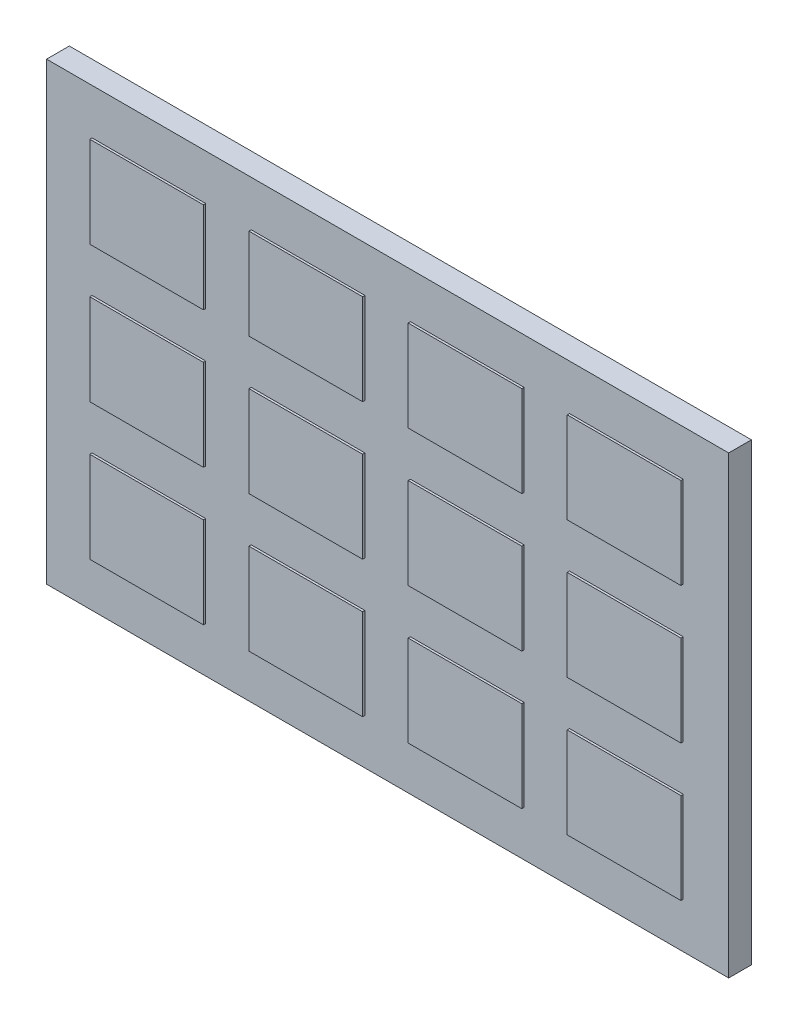
from build123d import *

# Parameters (mm, degrees)
SKETCH1_W            = 76.2
SKETCH1_H            = 50.8
BOSS_EXTRUDE2_DEPTH  = 2.54
SKETCH3_W            = 12.7
SKETCH3_H            = 10.16
BOSS_EXTRUDE3_DEPTH  = 0.254
LPATTERN2_COUNT      = 4
LPATTERN2_PITCH      = 17.78
LPATTERN2_COUNT_DIR2 = 3
LPATTERN2_PITCH_DIR2 = 15.24


with BuildPart() as part:
    # Sketch1 → Boss-Extrude2 (new body)
    with BuildSketch(Plane.XY):
        Rectangle(SKETCH1_W, SKETCH1_H)
    extrude(amount=BOSS_EXTRUDE2_DEPTH)

    # Sketch3 → Boss-Extrude3 (add)
    with BuildSketch(Plane.XY.offset(2.54)):
        with Locations((-26.67, 15.24)):
            Rectangle(SKETCH3_W, SKETCH3_H)
    boss_extrude3 = extrude(amount=BOSS_EXTRUDE3_DEPTH)

    # LPattern2: Boss-Extrude3 4 × 3
    with Locations(*[(i * LPATTERN2_PITCH, -j * LPATTERN2_PITCH_DIR2, 0) for i in range(LPATTERN2_COUNT) for j in range(LPATTERN2_COUNT_DIR2) if (i, j) != (0, 0)]):
        add(boss_extrude3)


solid = part.part
